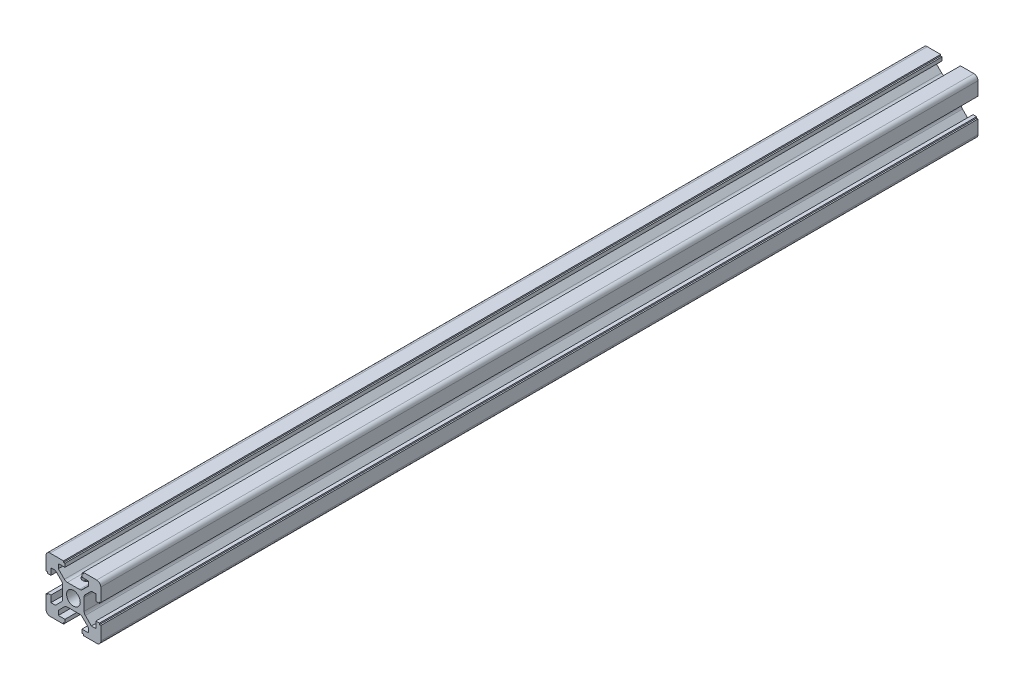
from build123d import *

# Parameters (mm, degrees)
SKETCH_1_R          = 2.5
EXTRUDE_1_DEPTH     = 160
SKETCH_3_R          = 1.6
CUT_EXTRUDE_1_DEPTH = 162.554944214


with BuildPart() as part:
    # 草图1 → 凸台-拉伸1 (new, symmetric)
    with BuildSketch(Plane.XY):
        with BuildLine():
            Line((-6.560660172, 5.5), (-4.339339828, 3.278679656))
            ThreePointArc((-4.339339828, 3.278679656), (-4.014180701, 2.792044633), (-3.9, 2.218019485))
            Line((-3.9, 2.218019485), (-3.9, -2.218019485))
            ThreePointArc((-3.9, -2.218019485), (-4.014180701, -2.792044633), (-4.339339828, -3.278679656))
            Line((-4.339339828, -3.278679656), (-6.560660172, -5.5))
            Line((-6.560660172, -5.5), (-8.2, -5.5))
            Line((-8.2, -5.5), (-8.2, -3.1))
            Line((-8.2, -3.1), (-9.5, -3.1))
            Line((-9.5, -3.1), (-9.5, -3.6))
            Line((-9.5, -3.6), (-10, -3.6))
            Line((-10, -3.6), (-10, -8.5))
            ThreePointArc((-10, -8.5), (-9.560660172, -9.560660172), (-8.5, -10))
            Line((-8.5, -10), (-3.6, -10))
            Line((-3.6, -10), (-3.6, -9.5))
            Line((-3.6, -9.5), (-3.1, -9.5))
            Line((-3.1, -9.5), (-3.1, -8.2))
            Line((-3.1, -8.2), (-5.5, -8.2))
            Line((-5.5, -8.2), (-5.5, -6.560660172))
            Line((-5.5, -6.560660172), (-3.278679656, -4.339339828))
            ThreePointArc((-3.278679656, -4.339339828), (-2.792044633, -4.014180701), (-2.218019485, -3.9))
            Line((-2.218019485, -3.9), (2.218019485, -3.9))
            ThreePointArc((2.218019485, -3.9), (2.792044633, -4.014180701), (3.278679656, -4.339339828))
            Line((3.278679656, -4.339339828), (5.5, -6.560660172))
            Line((5.5, -6.560660172), (5.5, -8.2))
            Line((5.5, -8.2), (3.1, -8.2))
            Line((3.1, -8.2), (3.1, -9.5))
            Line((3.1, -9.5), (3.6, -9.5))
            Line((3.6, -9.5), (3.6, -10))
            Line((3.6, -10), (8.5, -10))
            ThreePointArc((8.5, -10), (9.560660172, -9.560660172), (10, -8.5))
            Line((10, -8.5), (10, -3.6))
            Line((10, -3.6), (9.5, -3.6))
            Line((9.5, -3.6), (9.5, -3.1))
            Line((9.5, -3.1), (8.2, -3.1))
            Line((8.2, -3.1), (8.2, -5.5))
            Line((8.2, -5.5), (6.560660172, -5.5))
            Line((6.560660172, -5.5), (4.339339828, -3.278679656))
            ThreePointArc((4.339339828, -3.278679656), (4.014180701, -2.792044633), (3.9, -2.218019485))
            Line((3.9, -2.218019485), (3.9, 2.218019485))
            ThreePointArc((3.9, 2.218019485), (4.014180701, 2.792044633), (4.339339828, 3.278679656))
            Line((4.339339828, 3.278679656), (6.560660172, 5.5))
            Line((6.560660172, 5.5), (8.2, 5.5))
            Line((8.2, 5.5), (8.2, 3.1))
            Line((8.2, 3.1), (9.5, 3.1))
            Line((9.5, 3.1), (9.5, 3.6))
            Line((9.5, 3.6), (10, 3.6))
            Line((10, 3.6), (10, 8.5))
            ThreePointArc((10, 8.5), (9.560660172, 9.560660172), (8.5, 10))
            Line((8.5, 10), (3.6, 10))
            Line((3.6, 10), (3.6, 9.5))
            Line((3.6, 9.5), (3.1, 9.5))
            Line((3.1, 9.5), (3.1, 8.2))
            Line((3.1, 8.2), (5.5, 8.2))
            Line((5.5, 8.2), (5.5, 6.560660172))
            Line((5.5, 6.560660172), (3.278679656, 4.339339828))
            ThreePointArc((3.278679656, 4.339339828), (2.792044633, 4.014180701), (2.218019485, 3.9))
            Line((2.218019485, 3.9), (-2.218019485, 3.9))
            ThreePointArc((-2.218019485, 3.9), (-2.792044633, 4.014180701), (-3.278679656, 4.339339828))
            Line((-3.278679656, 4.339339828), (-5.5, 6.560660172))
            Line((-5.5, 6.560660172), (-5.5, 8.2))
            Line((-5.5, 8.2), (-3.1, 8.2))
            Line((-3.1, 8.2), (-3.1, 9.5))
            Line((-3.1, 9.5), (-3.6, 9.5))
            Line((-3.6, 9.5), (-3.6, 10))
            Line((-3.6, 10), (-8.5, 10))
            ThreePointArc((-8.5, 10), (-9.560660172, 9.560660172), (-10, 8.5))
            Line((-10, 8.5), (-10, 3.6))
            Line((-10, 3.6), (-9.5, 3.6))
            Line((-9.5, 3.6), (-9.5, 3.1))
            Line((-9.5, 3.1), (-8.2, 3.1))
            Line((-8.2, 3.1), (-8.2, 5.5))
            Line((-8.2, 5.5), (-6.560660172, 5.5))
        make_face()
        Circle(SKETCH_1_R, mode=Mode.SUBTRACT)
    extrude(amount=EXTRUDE_1_DEPTH, both=True)

    # 草图3 → 切除-拉伸1 (cut, through all)
    with BuildSketch(Plane(origin=(0, 10, 0), x_dir=(1, 0, 0), z_dir=(0, 1, 0))):
        with Locations(Location((0, 155, 0), (0, 0, 270))):
            Circle(SKETCH_3_R)
        with Locations(Location((0, 140, 0), (0, 0, 270))):
            Circle(SKETCH_3_R)
        with Locations(Location((0, -155, 0), (0, 0, 270))):
            Circle(SKETCH_3_R)
        with Locations(Location((0, -140, 0), (0, 0, 270))):
            Circle(SKETCH_3_R)
    extrude(amount=-CUT_EXTRUDE_1_DEPTH, mode=Mode.SUBTRACT)


solid = part.part
